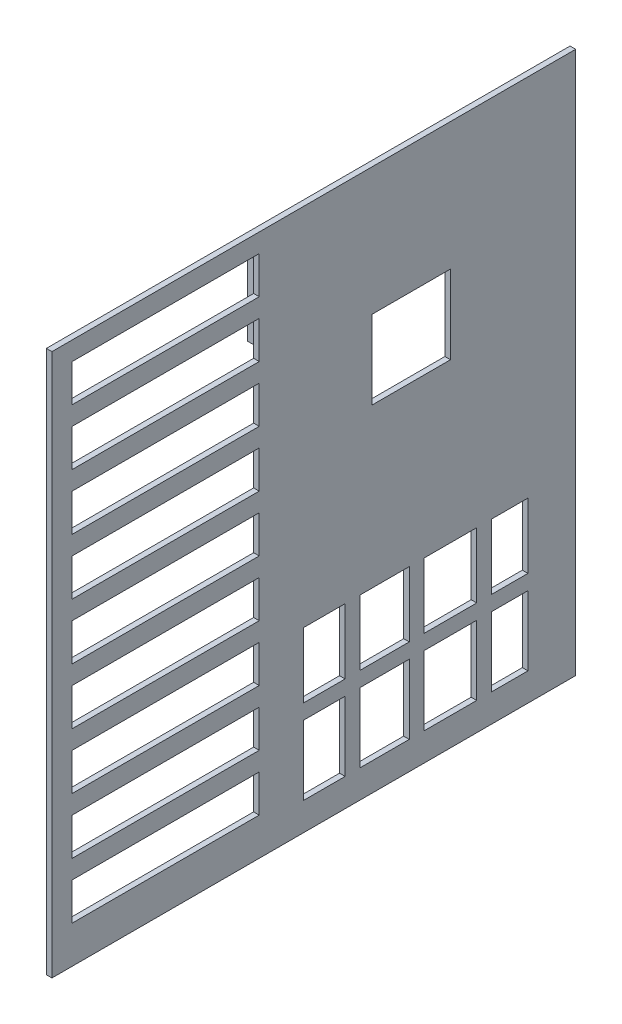
from build123d import *

# Parameters (mm, degrees)
SKETCH_1_W             = 280
SKETCH_1_H             = 290
EXTRUDE_1_DEPTH        = 3
SKETCH_2_W             = 42
SKETCH_2_H             = 42
CUT_EXTRUDE_1_DEPTH    = 3
SKETCH_3_W             = 122
SKETCH_3_H             = 10
EXTRUDE_4_DEPTH        = 20
SKETCH_5_W             = 5
SKETCH_5_H             = 40
EXTRUDE_7_DEPTH        = 20
EXTRUDE_8_DEPTH        = 10
PATTERN_LINEAR_1_COUNT = 4
PATTERN_LINEAR_1_PITCH = 37.3
SKETCH_7_W             = 100
SKETCH_7_H             = 20
CUT_EXTRUDE_3_DEPTH    = 3
PATTERN_LINEAR_2_COUNT = 9
PATTERN_LINEAR_2_PITCH = 30
SKETCH_8_W             = 19.372377966
SKETCH_8_H             = 34.870206367
SKETCH_8_W_2           = 28.060398732
SKETCH_8_W_3           = 26.290591332
SKETCH_8_W_4           = 22.27663197
SKETCH_8_H_2           = 37.129793633
CUT_EXTRUDE_4_DEPTH    = 3


with BuildPart() as part:
    # 草图1 → 凸台-拉伸1 (new body)
    with BuildSketch(Plane(origin=(0, 0, 0), x_dir=(0, 0, -1), z_dir=(1, 0, 0))):
        with Locations((101.929406601, -104.613945148)):
            Rectangle(SKETCH_1_W, SKETCH_1_H)
    extrude(amount=EXTRUDE_1_DEPTH)

    # 草图2 → 切除-拉伸1 (cut)
    with BuildSketch(Plane.ZY):
        with Locations((-154.017718623, -48.907355815)):
            Rectangle(SKETCH_2_W, SKETCH_2_H)
    extrude(amount=-CUT_EXTRUDE_1_DEPTH, mode=Mode.SUBTRACT)

    # 草图3 → 凸台-拉伸4 (add)
    with BuildSketch(Plane.ZY):
        with Locations((-155.503619283, -115.067977161)):
            Rectangle(SKETCH_3_W, SKETCH_3_H)
    extrude(amount=EXTRUDE_4_DEPTH)

    # 草图5 → 凸台-拉伸7 (add)
    with BuildSketch(Plane.ZY):
        with Locations((-219.003619283, -10.067977161)):
            Rectangle(SKETCH_5_W, SKETCH_5_H)
        with Locations((-92.003619283, -10.067977161)):
            Rectangle(SKETCH_5_W, SKETCH_5_H)
    extrude(amount=EXTRUDE_7_DEPTH)

    # 草图6 → 凸台-拉伸8 (add)
    with BuildSketch(Plane.XY.offset(-94.503619283)):
        Polygon((-20, -120.067977161), (0, -120.067977161), (0, -140.067977161), align=None)
    extrude_8 = extrude(amount=-EXTRUDE_8_DEPTH)

    # 阵列(线性)1: 凸台-拉伸8 ×4
    with Locations(*[(0, 0, -i * PATTERN_LINEAR_1_PITCH) for i in range(1, PATTERN_LINEAR_1_COUNT)]):
        add(extrude_8)

    # 草图7 → 切除-拉伸3 (cut)
    with BuildSketch(Plane.ZY):
        with Locations((-22.758250254, 20.386054852)):
            Rectangle(SKETCH_7_W, SKETCH_7_H)
    cut_extrude_3 = extrude(amount=-CUT_EXTRUDE_3_DEPTH, mode=Mode.SUBTRACT)

    # 阵列(线性)2: 切除-拉伸3 ×9
    with Locations(*[(0, -i * PATTERN_LINEAR_2_PITCH, 0) for i in range(1, PATTERN_LINEAR_2_COUNT)]):
        add(cut_extrude_3, mode=Mode.SUBTRACT)

    # 草图8 → 切除-拉伸4 (cut)
    with BuildSketch(Plane.ZY):
        with Locations((-206.7174303, -172.090616985)):
            Rectangle(SKETCH_8_W, SKETCH_8_H)
        with Locations((-175.001041951, -172.090616985)):
            Rectangle(SKETCH_8_W_2, SKETCH_8_H)
        with Locations((-139.825546919, -172.090616985)):
            Rectangle(SKETCH_8_W_3, SKETCH_8_H)
        with Locations((-107.541935268, -172.090616985)):
            Rectangle(SKETCH_8_W_4, SKETCH_8_H)
        with Locations((-107.541935268, -216.090616985)):
            Rectangle(SKETCH_8_W_4, SKETCH_8_H_2)
        with Locations((-139.825546919, -216.090616985)):
            Rectangle(SKETCH_8_W_3, SKETCH_8_H_2)
        with Locations((-175.001041951, -216.090616985)):
            Rectangle(SKETCH_8_W_2, SKETCH_8_H_2)
        with Locations((-206.7174303, -216.090616985)):
            Rectangle(SKETCH_8_W, SKETCH_8_H_2)
    extrude(amount=-CUT_EXTRUDE_4_DEPTH, mode=Mode.SUBTRACT)


solid = part.part
